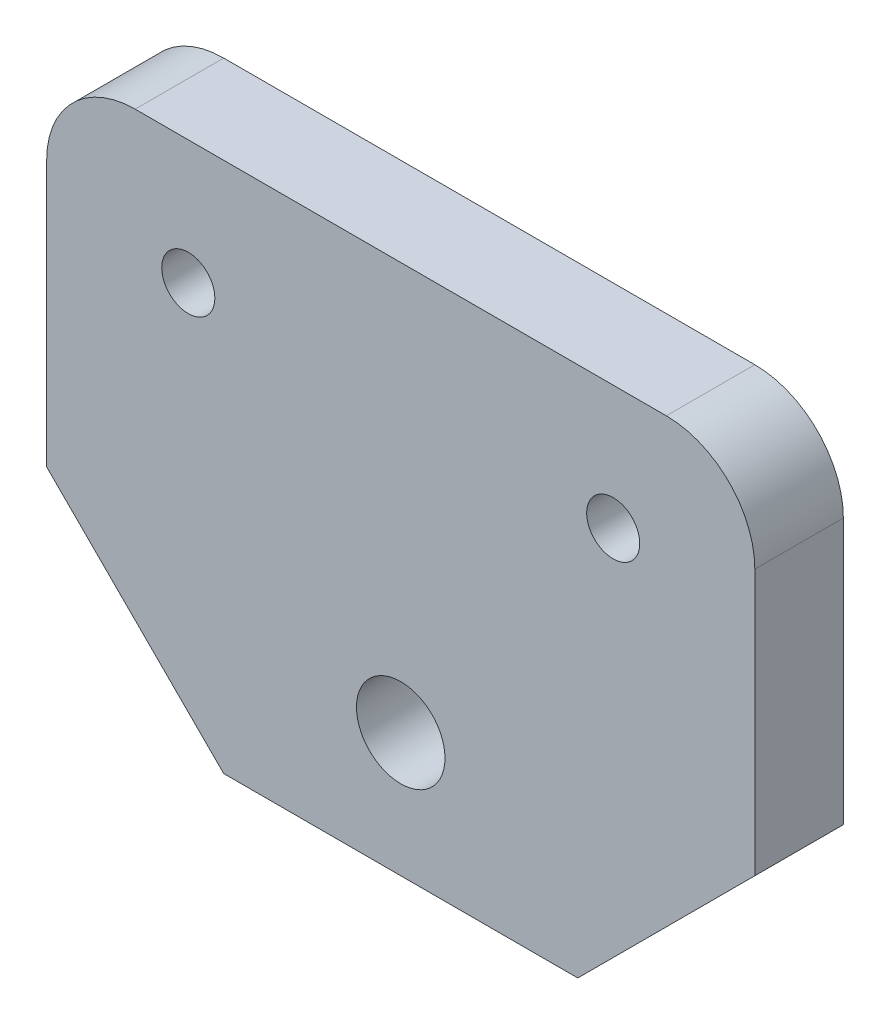
from build123d import *

# Parameters (mm, degrees)
ESQUISSE1_W                  = 40
ESQUISSE1_H                  = 30
BOSS_EXTRU_1_DEPTH           = 5
ENL_V_MAT_EXTRU_1_DEPTH      = 51.249378106
ENL_V_MAT_EXTRU_1_DEPTH_BACK = 51.249378106
ESQUISSE2_R                  = 1.5
ESQUISSE2_R_2                = 2.5
CHANFREIN1_SIZE              = 10
CONG_1_R                     = 5


with BuildPart() as part:
    # Esquisse1 → Boss.-Extru.1 (new body)
    with BuildSketch(Plane.XY):
        with Locations((20, 15)):
            Rectangle(ESQUISSE1_W, ESQUISSE1_H)
    extrude(amount=BOSS_EXTRU_1_DEPTH)

    # Esquisse2 → Enlèv. mat.-Extru.1 (cut, two sides: drawn at the far end of the back side and taken through both)
    with BuildSketch(Plane.XY.offset(5).offset(-ENL_V_MAT_EXTRU_1_DEPTH_BACK)):
        with Locations((8, 23)):
            Circle(ESQUISSE2_R)
        with Locations(Location((32, 23, 0), (0, 0, 180))):
            Circle(ESQUISSE2_R)
        with Locations((20, 7)):
            Circle(ESQUISSE2_R_2)
    extrude(amount=ENL_V_MAT_EXTRU_1_DEPTH + ENL_V_MAT_EXTRU_1_DEPTH_BACK, mode=Mode.SUBTRACT)

    # Chanfrein1
    chanfrein1_edges = [part.edges().sort_by_distance(p)[0] for p in [
        (40, 0, 2.5),
        (0, 0, 2.5),
    ]]
    chamfer(chanfrein1_edges, length=CHANFREIN1_SIZE)

    # Congé1
    cong_1_edges = [part.edges().sort_by_distance(p)[0] for p in [
        (0, 30, 2.5),
        (40, 30, 2.5),
    ]]
    fillet(cong_1_edges, radius=CONG_1_R)


solid = part.part
